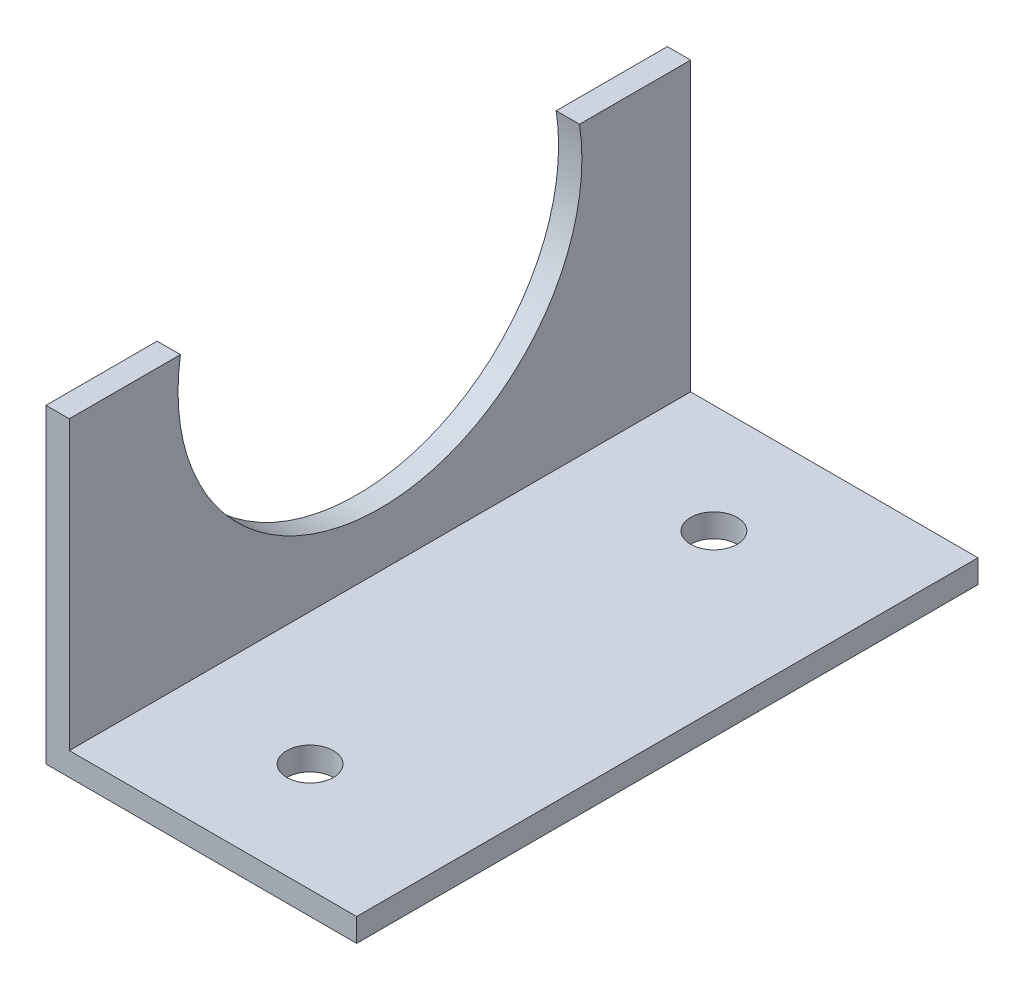
from build123d import *

# Parameters (mm, degrees)
EXTRUSION1_DEPTH = 40
ESQUISSE2_R      = 13
EXTRUSION2_DEPTH = 30
ESQUISSE3_R      = 1.5
EXTRUSION3_DEPTH = 49.396797415


with BuildPart() as part:
    # Esquisse1 → Extrusion1 (new body)
    with BuildSketch(Plane.XY):
        Polygon((0, 0), (0, 20), (1.5, 20), (1.5, 1.5), (20, 1.5), (20, 0), align=None)
    extrude(amount=EXTRUSION1_DEPTH)

    # Esquisse2 → Extrusion2 (cut)
    with BuildSketch(Plane(origin=(1.5, 0, 0), x_dir=(0, 0, -1), z_dir=(1, 0, 0))):
        with Locations((-20, 18)):
            Circle(ESQUISSE2_R)
    extrude(amount=-EXTRUSION2_DEPTH, mode=Mode.SUBTRACT)

    # Esquisse3 → Extrusion3 (cut, through all)
    with BuildSketch(Plane(origin=(0, 1.5, 0), x_dir=(-1, 0, 0), z_dir=(0, 1, 0))):
        with Locations((-10, 33)):
            Circle(ESQUISSE3_R)
        with Locations((-10, 7)):
            Circle(ESQUISSE3_R)
    extrude(amount=-EXTRUSION3_DEPTH, mode=Mode.SUBTRACT)


solid = part.part
